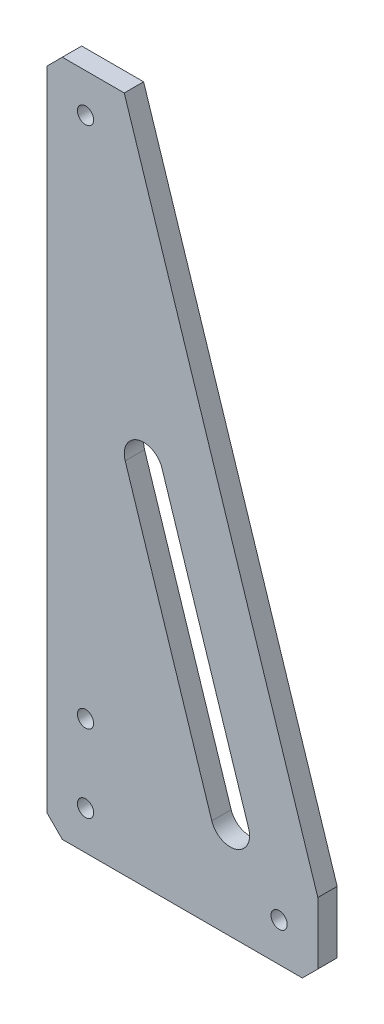
from build123d import *

# Parameters (mm, degrees)
SKETCH_1_R          = 2.1
EXTRUDE_1_DEPTH     = 2.5
CHAMFER_1_SIZE      = 4
CHAMFER_2_SIZE      = 2
CUT_EXTRUDE_1_DEPTH = 95.372930441


with BuildPart() as part:
    # 草图1 → 凸台-拉伸1 (new, symmetric)
    with BuildSketch(Plane.XY):
        Polygon((-35, 87.5), (-35, -87.5), (35, -87.5), (35, -67.5), (-15, 87.5), align=None)
        with Locations((-25, -77.5)):
            Circle(SKETCH_1_R, mode=Mode.SUBTRACT)
        with Locations((25, -77.5)):
            Circle(SKETCH_1_R, mode=Mode.SUBTRACT)
        with Locations((-25, 77.5)):
            Circle(SKETCH_1_R, mode=Mode.SUBTRACT)
        with Locations((-25, -57.5)):
            Circle(SKETCH_1_R, mode=Mode.SUBTRACT)
    extrude(amount=EXTRUDE_1_DEPTH, both=True)

    # 倒角1
    chamfer_1_edges = [part.edges().sort_by_distance(p)[0] for p in [
        (-35, -87.5, 0),
        (-35, 87.5, 0),
        (35, -87.5, 0),
    ]]
    chamfer(chamfer_1_edges, length=CHAMFER_1_SIZE)

    # 倒角2
    chamfer_2_edges = [part.edges().sort_by_distance(p)[0] for p in [
        (22.9, -77.5, -2.5),
        (-27.1, -77.5, -2.5),
        (-27.1, 77.5, -2.5),
        (-27.1, -57.5, -2.5),
    ]]
    chamfer(chamfer_2_edges, length=CHAMFER_2_SIZE)

    # 草图2 → 切除-拉伸1 (cut, through all)
    with BuildSketch(Plane(origin=(0, 0, -2.5), x_dir=(-1, 0, 0), z_dir=(0, 0, -1))):
        with BuildLine():
            Line((-17.130804412, -60.9649861), (5.241456911, 8.389024))
            ThreePointArc((5.241456911, 8.389024), (11.5350139, 11.612553189), (14.758543089, 5.318996201))
            Line((14.758543089, 5.318996201), (-7.613718234, -64.0350139))
            ThreePointArc((-7.613718234, -64.0350139), (-13.907275222, -67.258543089), (-17.130804412, -60.9649861))
        make_face()
    extrude(amount=-CUT_EXTRUDE_1_DEPTH, mode=Mode.SUBTRACT)


solid = part.part
